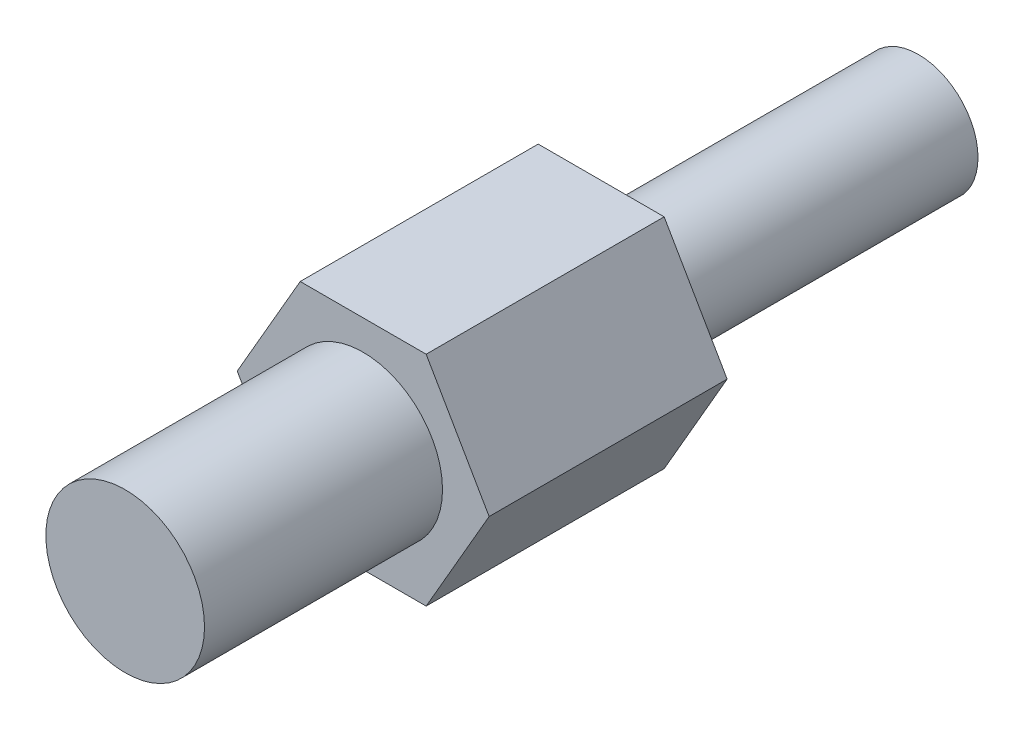
from build123d import *

# Parameters (mm, degrees)
EXTRUDE_1_DEPTH = 6
SKETCH_2_R      = 2
EXTRUDE_2_DEPTH = 6
SKETCH_6_R      = 1.5
EXTRUDE_3_DEPTH = 8


with BuildPart() as part:
    # 草图1 → 拉伸1 (new body)
    with BuildSketch(Plane.XY):
        Polygon((1.58771324, -2.75), (3.175426481, 0), (1.58771324, 2.75), (-1.58771324, 2.75), (-3.175426481, 0), (-1.58771324, -2.75), align=None)
    extrude(amount=EXTRUDE_1_DEPTH)

    # 草图2 → 拉伸2 (add)
    with BuildSketch(Plane.XY.offset(6)):
        Circle(SKETCH_2_R)
    extrude(amount=EXTRUDE_2_DEPTH)

    # 草图6 → 拉伸3 (add)
    with BuildSketch(Plane(origin=(0, 0, 0), x_dir=(-1, 0, 0), z_dir=(0, 0, -1))):
        with Locations(Location((0, 0, 0), (0, 0, 180))):
            Circle(SKETCH_6_R)
    extrude(amount=EXTRUDE_3_DEPTH)


solid = part.part
